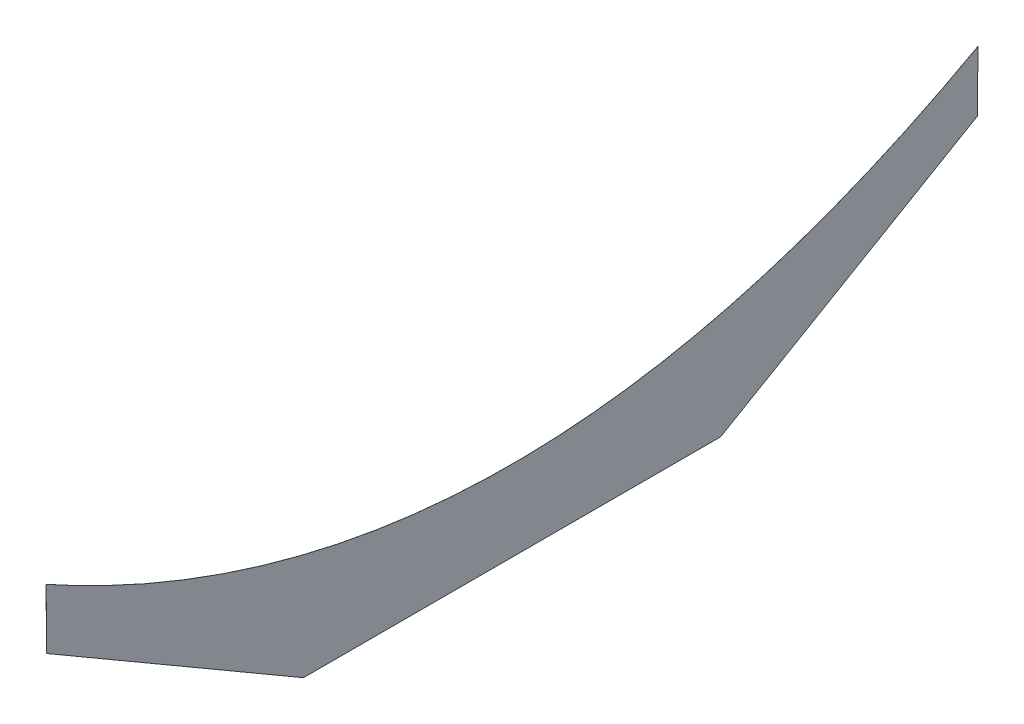
from build123d import *

# Parameters (mm, degrees)
BOSS_EXTRUDE1_DEPTH = 0.127


with BuildPart() as part:
    # Sketch1 → Boss-Extrude1 (new body)
    with BuildSketch(Plane(origin=(0, 0, 0), x_dir=(0, 0, -1), z_dir=(1, 0, 0))):
        with BuildLine():
            Line((734.40708933, 124.676146582), (733.357043785, 29.761237691))
            Line((733.357043785, 29.761237691), (328.770751491, -205.523937709))
            Line((328.770751491, -205.523937709), (-328.770779224, -205.523937708))
            Line((-328.770779224, -205.523937708), (-733.357071518, 29.761237693))
            Line((-733.357071518, 29.761237693), (-734.407163707, 124.676062292))
            add(Edge.make_bspline(
                [(-1.3866e-05, -78.523920986), (-367.203581261, -78.523944347), (-734.407163707, 124.676062292)],
                knots=[0, 0, 0, 1, 1, 1], degree=2))
            add(Edge.make_bspline(
                [(-1.3866e-05, -78.523920986), (367.203545257, -78.523897625), (734.40708933, 124.676146582)],
                knots=[0, 0, 0, 1, 1, 1], degree=2))
        make_face()
    extrude(amount=BOSS_EXTRUDE1_DEPTH)


solid = part.part
